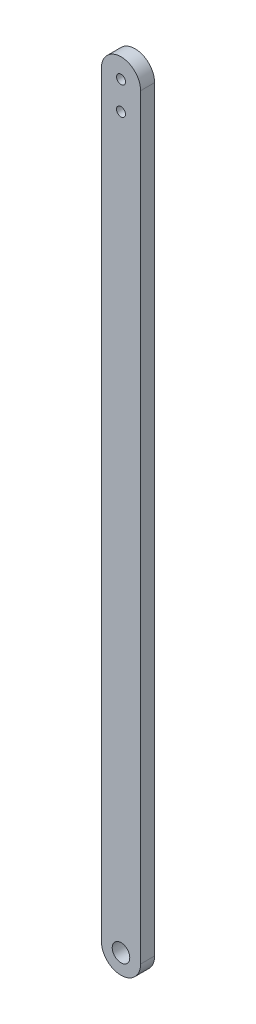
from build123d import *

# Parameters (mm, degrees)
SKETCH1_R           = 3.130555183
BOSS_EXTRUDE1_DEPTH = 5
SKETCH2_R           = 1.6
CUT_EXTRUDE1_DEPTH  = 10


with BuildPart() as part:
    # Sketch1 → Boss-Extrude1 (new body)
    with BuildSketch(Plane.XY):
        with BuildLine():
            Line((7, 270), (7, 0))
            ThreePointArc((7, 0), (0, -7), (-7, 0))
            Line((-7, 0), (-7, 270))
            ThreePointArc((-7, 270), (0, 277), (7, 270))
        make_face()
        Circle(SKETCH1_R, mode=Mode.SUBTRACT)
    extrude(amount=BOSS_EXTRUDE1_DEPTH)

    # Sketch2 → Cut-Extrude1 (cut)
    with BuildSketch(Plane.XY.offset(5)):
        with Locations((0, 270)):
            Circle(SKETCH2_R)
        with Locations((0, 260)):
            Circle(SKETCH2_R)
    extrude(amount=-CUT_EXTRUDE1_DEPTH, mode=Mode.SUBTRACT)


solid = part.part
